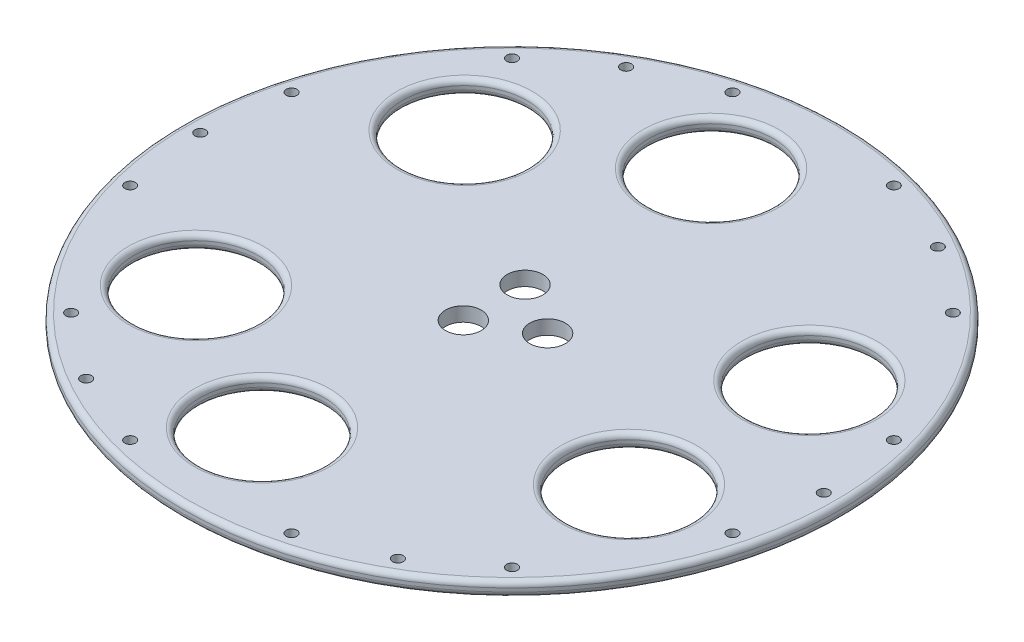
from build123d import *

# Parameters (mm, degrees)
SKETCH1_R           = 92.5
BOSS_EXTRUDE1_DEPTH = 4
SKETCH2_R           = 17.5
SKETCH2_R_2         = 1.5
SKETCH2_R_3         = 5
CUT_EXTRUDE1_DEPTH  = 131.875895412
FILLET1_R           = 1.5


with BuildPart() as part:
    # Sketch1 → Boss-Extrude1 (new body)
    with BuildSketch(Plane(origin=(0, 0, 0), x_dir=(1, 0, 0), z_dir=(0, 1, 0))):
        with Locations(Location((0, 0, 0), (0, 0, 270))):
            Circle(SKETCH1_R)
    extrude(amount=BOSS_EXTRUDE1_DEPTH)

    # Sketch2 → Cut-Extrude1 (cut, through all)
    with BuildSketch(Plane(origin=(0, 4, 0), x_dir=(1, 0, 0), z_dir=(0, 1, 0))):
        with Locations(Location((-50.996839233, 37.699999868, 0), (0, 0, 270))):
            Circle(SKETCH2_R)
        with Locations(Location((-43.75, 75.777222831, 0), (0, 0, 270))):
            Circle(SKETCH2_R_2)
        with Locations(Location((-7.147577225, 63.020032831, 0), (0, 0, 270))):
            Circle(SKETCH2_R)
        with Locations(Location((-5, 8.660254038, 0), (0, 0, 270))):
            Circle(SKETCH2_R_3)
        with Locations(Location((-22.646666446, 84.5185098, 0), (0, 0, 270))):
            Circle(SKETCH2_R_2)
        with Locations(Location((-61.871843354, 61.871843354, 0), (0, 0, 270))):
            Circle(SKETCH2_R_2)
        with Locations(Location((43.75, 75.777222831, 0), (0, 0, 270))):
            Circle(SKETCH2_R_2)
        with Locations(Location((22.646666446, 84.5185098, 0), (0, 0, 270))):
            Circle(SKETCH2_R_2)
        with Locations(Location((61.871843354, 61.871843354, 0), (0, 0, 270))):
            Circle(SKETCH2_R_2)
        with Locations(Location((87.5, 0, 0), (0, 0, 270))):
            Circle(SKETCH2_R_2)
        with Locations(Location((84.5185098, 22.646666446, 0), (0, 0, 270))):
            Circle(SKETCH2_R_2)
        with Locations(Location((84.5185098, -22.646666446, 0), (0, 0, 270))):
            Circle(SKETCH2_R_2)
        with Locations(Location((58.150737991, -25.320032963, 0), (0, 0, 270))):
            Circle(SKETCH2_R)
        with Locations(Location((58.147577225, 25.314558355, 0), (0, 0, 270))):
            Circle(SKETCH2_R)
        with Locations(Location((-51.003160767, -37.699999867, 0), (0, 0, 270))):
            Circle(SKETCH2_R)
        with Locations(Location((-7.150737991, -63.014558223, 0), (0, 0, 270))):
            Circle(SKETCH2_R)
        with Locations(Location((10, 0, 0), (0, 0, 270))):
            Circle(SKETCH2_R_3)
        with Locations(Location((-5, -8.660254038, 0), (0, 0, 270))):
            Circle(SKETCH2_R_3)
        with Locations(Location((43.75, -75.777222831, 0), (0, 0, 270))):
            Circle(SKETCH2_R_2)
        with Locations(Location((61.871843354, -61.871843354, 0), (0, 0, 270))):
            Circle(SKETCH2_R_2)
        with Locations(Location((22.646666446, -84.5185098, 0), (0, 0, 270))):
            Circle(SKETCH2_R_2)
        with Locations(Location((-43.75, -75.777222831, 0), (0, 0, 270))):
            Circle(SKETCH2_R_2)
        with Locations(Location((-22.646666446, -84.5185098, 0), (0, 0, 270))):
            Circle(SKETCH2_R_2)
        with Locations(Location((-61.871843354, -61.871843354, 0), (0, 0, 270))):
            Circle(SKETCH2_R_2)
        with Locations(Location((-87.5, 0, 0), (0, 0, 270))):
            Circle(SKETCH2_R_2)
        with Locations(Location((-84.5185098, -22.646666446, 0), (0, 0, 270))):
            Circle(SKETCH2_R_2)
        with Locations(Location((-84.5185098, 22.646666446, 0), (0, 0, 270))):
            Circle(SKETCH2_R_2)
    extrude(amount=-CUT_EXTRUDE1_DEPTH, mode=Mode.SUBTRACT)

    # Fillet1
    fillet1_edges = [part.edges().sort_by_distance(p)[0] for p in [
        (0, 0, -92.5),
        (0, 4, -92.5),
        (-7.147577225, 0, -80.520032831),
        (-7.147577225, 4, -80.520032831),
        (58.147577225, 0, -42.814558355),
        (58.147577225, 4, -42.814558355),
        (58.150737991, 0, 7.820032963),
        (58.150737991, 4, 7.820032963),
        (-7.150737991, 0, 45.514558223),
        (-7.150737991, 4, 45.514558223),
        (-51.003160767, 0, 20.199999867),
        (-51.003160767, 4, 20.199999867),
        (-50.996839233, 0, -55.199999868),
        (-50.996839233, 4, -55.199999868),
    ]]
    fillet(fillet1_edges, radius=FILLET1_R)


solid = part.part
